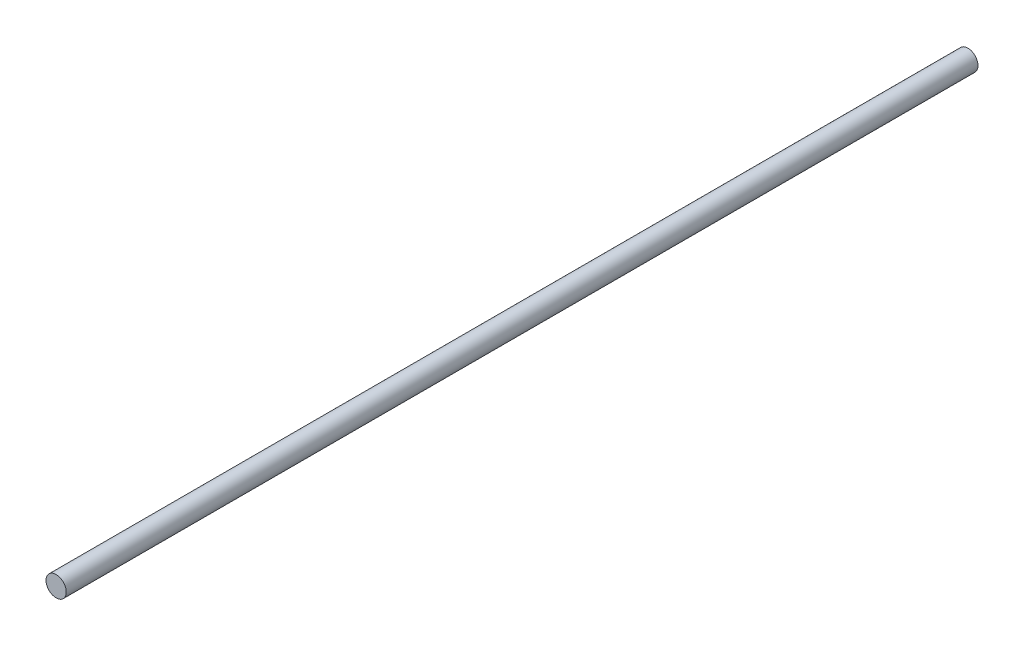
from build123d import *

# Parameters (mm, degrees)
ESBO_O1_R                = 4
RESSALTO_EXTRUS_O1_DEPTH = 360


with BuildPart() as part:
    # Esboço1 → Ressalto-extrusão1 (new body)
    with BuildSketch(Plane.XY):
        with Locations(Location((0, 0, 0), (0, 0, 180))):
            Circle(ESBO_O1_R)
    extrude(amount=RESSALTO_EXTRUS_O1_DEPTH)


solid = part.part
